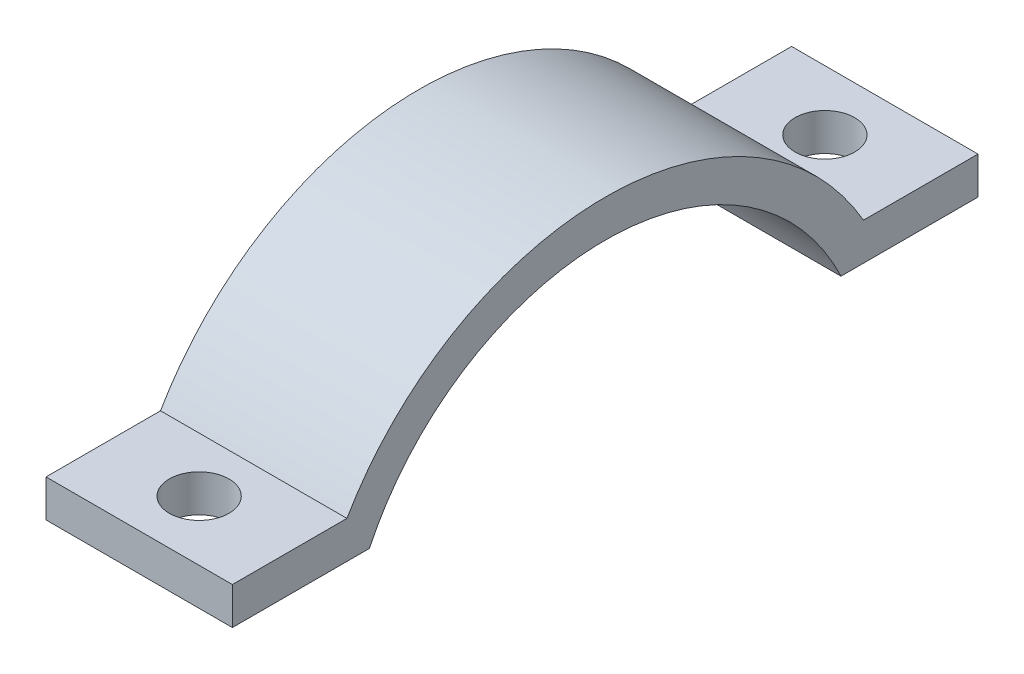
from build123d import *

# Parameters (mm, degrees)
EXTRUDE_1_DEPTH     = 10
SKETCH_3_R          = 1.6
CUT_EXTRUDE_1_DEPTH = 10


with BuildPart() as part:
    # 草图2 → 凸台-拉伸1 (new body)
    with BuildSketch(Plane(origin=(0, 0, 0), x_dir=(0, 0, -1), z_dir=(1, 0, 0))):
        with BuildLine():
            Line((-12.649110641, 6), (-20, 6))
            Line((-20, 6), (-20, 8))
            Line((-20, 8), (-13.856406461, 8))
            ThreePointArc((-13.856406461, 8), (0, 16), (13.856406461, 8))
            Line((13.856406461, 8), (20, 8))
            Line((20, 8), (20, 6))
            Line((20, 6), (12.649110641, 6))
            ThreePointArc((12.649110641, 6), (0, 14), (-12.649110641, 6))
        make_face()
    extrude(amount=EXTRUDE_1_DEPTH)

    # 草图3 → 切除-拉伸1 (cut)
    with BuildSketch(Plane(origin=(0, 8, 0), x_dir=(1, 0, 0), z_dir=(0, 1, 0))):
        with Locations(Location((5, 16.785, 0), (0, 0, 270))):
            Circle(SKETCH_3_R)
        with Locations(Location((5, -16.785, 0), (0, 0, 270))):
            Circle(SKETCH_3_R)
    extrude(amount=-CUT_EXTRUDE_1_DEPTH, mode=Mode.SUBTRACT)


solid = part.part
